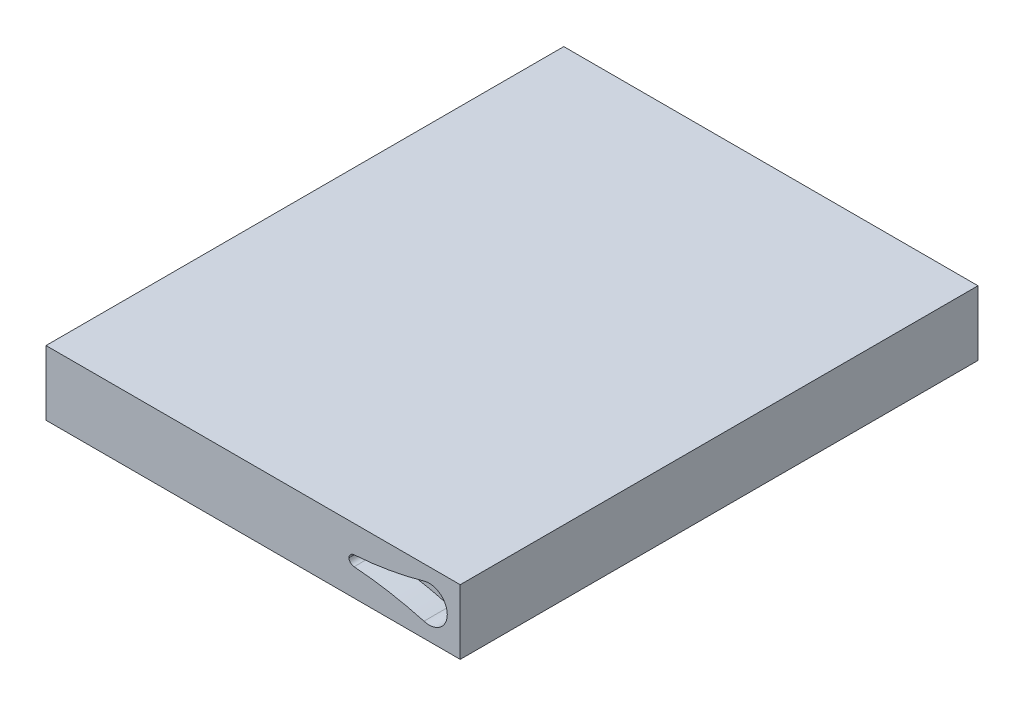
from build123d import *

# Parameters (mm, degrees)
SKETCH1_W           = 80
SKETCH1_H           = 100
BOSS_EXTRUDE1_DEPTH = 12.5
CUT_EXTRUDE1_DEPTH  = 5
CUT_EXTRUDE4_START  = 5
CUT_EXTRUDE4_DEPTH  = 5


with BuildPart() as part:
    # Sketch1 → Boss-Extrude1 (new body)
    with BuildSketch(Plane(origin=(0, 0, 0), x_dir=(1, 0, 0), z_dir=(0, 1, 0))):
        with Locations((40, 50)):
            Rectangle(SKETCH1_W, SKETCH1_H)
    extrude(amount=BOSS_EXTRUDE1_DEPTH)

    # Sketch2 → Cut-Extrude1 (cut)
    with BuildSketch(Plane.XY):
        with BuildLine():
            ThreePointArc((73, 2.895898034), (76.091650066, 3.44375696), (77.5, 6.25))
            Line((77.5, 6.25), (74, 6.25))
            Line((74, 6.25), (73, 6.25))
            Line((73, 6.25), (73, 2.895898034))
        make_face()
        with BuildLine():
            Line((74, 6.25), (77.5, 6.25))
            ThreePointArc((77.5, 6.25), (76.091650066, 9.05624304), (73, 9.604101966))
            Line((73, 9.604101966), (73, 6.25))
            Line((73, 6.25), (74, 6.25))
        make_face()
        with BuildLine():
            Line((73, 6.25), (73, 9.604101966))
            ThreePointArc((73, 9.604101966), (71.19375696, 8.341650066), (70.5, 6.25))
            Line((70.5, 6.25), (73, 6.25))
        make_face()
        with BuildLine():
            ThreePointArc((70.5, 6.25), (71.19375696, 4.158349934), (73, 2.895898034))
            Line((73, 2.895898034), (73, 6.25))
            Line((73, 6.25), (70.5, 6.25))
        make_face()
        with BuildLine():
            ThreePointArc((59.5, 5.25), (66.307499895, 4.402691993), (73, 2.895898034))
            ThreePointArc((73, 2.895898034), (71.19375696, 4.158349934), (70.5, 6.25))
            Line((70.5, 6.25), (59.5, 6.25))
            Line((59.5, 6.25), (58.5, 6.25))
            ThreePointArc((58.5, 6.25), (58.814539324, 5.564539324), (59.5, 5.25))
        make_face()
        with BuildLine():
            ThreePointArc((70.5, 6.25), (71.19375696, 8.341650066), (73, 9.604101966))
            ThreePointArc((73, 9.604101966), (66.311170081, 8.076260701), (59.5, 7.25))
            ThreePointArc((59.5, 7.25), (58.812768212, 6.937231788), (58.5, 6.25))
            Line((58.5, 6.25), (59.5, 6.25))
            Line((59.5, 6.25), (70.5, 6.25))
        make_face()
    extrude(amount=-CUT_EXTRUDE1_DEPTH, mode=Mode.SUBTRACT)

    # Sketch6 → Cut-Extrude4 (cut)
    with BuildSketch(Plane.XY.offset(-100).offset(CUT_EXTRUDE4_START)):
        with BuildLine():
            ThreePointArc((73, 2.895898034), (77.5, 6.25), (73, 9.604101966))
            ThreePointArc((73, 9.604101966), (66.352079757, 7.840991059), (59.499996599, 7.247391846))
            ThreePointArc((59.499996599, 7.247391846), (58.499996599, 6.247391846), (59.499996599, 5.247391846))
            ThreePointArc((59.499996599, 5.247391846), (66.351631714, 4.655125717), (73, 2.895898034))
        make_face()
    extrude(amount=-CUT_EXTRUDE4_DEPTH, mode=Mode.SUBTRACT)


solid = part.part
